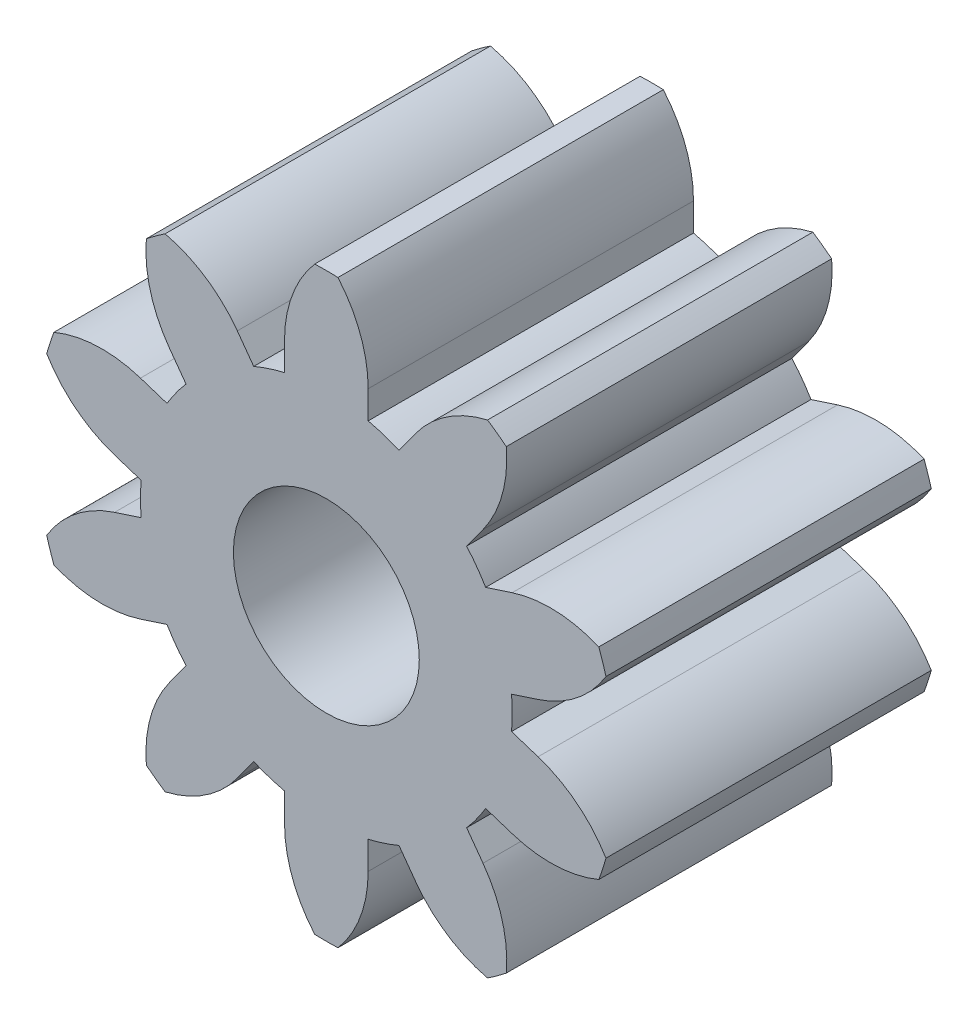
from build123d import *

# Parameters (mm, degrees)
ESBO_O1_R                = 2
RESSALTO_EXTRUS_O1_DEPTH = 3.5
CORTE_EXTRUS_O1_REACH    = 7.574
ESBO_O2_R                = 1


with BuildPart() as part:
    # Esboço1 → Ressalto-extrusão1 (new body)
    with BuildSketch(Plane.XY):
        Circle(ESBO_O1_R)
        with BuildLine():
            Line((-1.99959981, -1.122867364), (-1.714282855, -1.030162265))
            ThreePointArc((-1.714282855, -1.030162265), (-1.902113033, -0.618033989), (-1.99239815, -0.174211401))
            Line((-1.99239815, -0.174211401), (-2.277715105, -0.266916499))
            ThreePointArc((-2.277715105, -0.266916499), (-2.695113044, -0.490735084), (-3.008300145, -0.846023191))
            ThreePointArc((-3.008300145, -0.846023191), (-2.972051613, -0.965678107), (-2.931045896, -1.08378732))
            ThreePointArc((-2.931045896, -1.08378732), (-2.4688391, -1.187134677), (-1.99959981, -1.122867364))
        make_face()
        with BuildLine():
            Line((-2.277715105, 0.266916499), (-1.99239815, 0.174211401))
            ThreePointArc((-1.99239815, 0.174211401), (-1.902113033, 0.618033989), (-1.714282855, 1.030162265))
            Line((-1.714282855, 1.030162265), (-1.99959981, 1.122867364))
            ThreePointArc((-1.99959981, 1.122867364), (-2.4688391, 1.187134677), (-2.931045896, 1.08378732))
            ThreePointArc((-2.931045896, 1.08378732), (-2.972051613, 0.965678107), (-3.008300145, 0.846023191))
            ThreePointArc((-3.008300145, 0.846023191), (-2.695113044, 0.490735084), (-2.277715105, 0.266916499))
        make_face()
        with BuildLine():
            Line((-1.685820646, 1.554747331), (-1.509485071, 1.312042233))
            ThreePointArc((-1.509485071, 1.312042233), (-1.175570505, 1.618033989), (-0.781369776, 1.84104896))
            Line((-0.781369776, 1.84104896), (-0.957705351, 2.083754058))
            ThreePointArc((-0.957705351, 2.083754058), (-1.299552532, 2.411559342), (-1.734231738, 2.599627912))
            ThreePointArc((-1.734231738, 2.599627912), (-1.836828913, 2.528178107), (-1.936485986, 2.452681599))
            ThreePointArc((-1.936485986, 2.452681599), (-1.891945409, 1.981160724), (-1.685820646, 1.554747331))
        make_face()
        with BuildLine():
            Line((-0.45, 2.248717527), (-0.45, 1.948717527))
            ThreePointArc((-0.45, 1.948717527), (0, 2), (0.45, 1.948717527))
            Line((0.45, 1.948717527), (0.45, 2.248717527))
            ThreePointArc((0.45, 2.248717527), (0.366118933, 2.714850303), (0.125, 3.122498999))
            ThreePointArc((0.125, 3.122498999), (0, 3.125), (-0.125, 3.122498999))
            ThreePointArc((-0.125, 3.122498999), (-0.366118933, 2.714850303), (-0.45, 2.248717527))
        make_face()
        with BuildLine():
            ThreePointArc((0.781369776, 1.84104896), (1.175570505, 1.618033989), (1.509485071, 1.312042233))
            Line((1.509485071, 1.312042233), (1.685820646, 1.554747331))
            ThreePointArc((1.685820646, 1.554747331), (1.891945409, 1.981160724), (1.936485986, 2.452681599))
            ThreePointArc((1.936485986, 2.452681599), (1.836828913, 2.528178107), (1.734231738, 2.599627912))
            ThreePointArc((1.734231738, 2.599627912), (1.299552532, 2.411559342), (0.957705351, 2.083754058))
            Line((0.957705351, 2.083754058), (0.781369776, 1.84104896))
        make_face()
        with BuildLine():
            ThreePointArc((1.714282855, 1.030162265), (1.902113033, 0.618033989), (1.99239815, 0.174211401))
            Line((1.99239815, 0.174211401), (2.277715105, 0.266916499))
            ThreePointArc((2.277715105, 0.266916499), (2.695113044, 0.490735084), (3.008300145, 0.846023191))
            ThreePointArc((3.008300145, 0.846023191), (2.972051613, 0.965678107), (2.931045896, 1.08378732))
            ThreePointArc((2.931045896, 1.08378732), (2.4688391, 1.187134677), (1.99959981, 1.122867364))
            Line((1.99959981, 1.122867364), (1.714282855, 1.030162265))
        make_face()
        with BuildLine():
            ThreePointArc((1.99239815, -0.174211401), (1.902113033, -0.618033989), (1.714282855, -1.030162265))
            Line((1.714282855, -1.030162265), (1.99959981, -1.122867364))
            ThreePointArc((1.99959981, -1.122867364), (2.4688391, -1.187134677), (2.931045896, -1.08378732))
            ThreePointArc((2.931045896, -1.08378732), (2.972051613, -0.965678107), (3.008300145, -0.846023191))
            ThreePointArc((3.008300145, -0.846023191), (2.695113044, -0.490735084), (2.277715105, -0.266916499))
            Line((2.277715105, -0.266916499), (1.99239815, -0.174211401))
        make_face()
        with BuildLine():
            ThreePointArc((1.509485071, -1.312042233), (1.175570505, -1.618033989), (0.781369776, -1.84104896))
            Line((0.781369776, -1.84104896), (0.957705351, -2.083754058))
            ThreePointArc((0.957705351, -2.083754058), (1.299552532, -2.411559342), (1.734231738, -2.599627912))
            ThreePointArc((1.734231738, -2.599627912), (1.836828913, -2.528178107), (1.936485986, -2.452681599))
            ThreePointArc((1.936485986, -2.452681599), (1.891945409, -1.981160724), (1.685820646, -1.554747331))
            Line((1.685820646, -1.554747331), (1.509485071, -1.312042233))
        make_face()
        with BuildLine():
            Line((-0.45, -1.948717527), (-0.45, -2.248717527))
            ThreePointArc((-0.45, -2.248717527), (-0.366118933, -2.714850303), (-0.125, -3.122498999))
            ThreePointArc((-0.125, -3.122498999), (0, -3.125), (0.125, -3.122498999))
            ThreePointArc((0.125, -3.122498999), (0.366118933, -2.714850303), (0.45, -2.248717527))
            Line((0.45, -2.248717527), (0.45, -1.948717527))
            ThreePointArc((0.45, -1.948717527), (0, -2), (-0.45, -1.948717527))
        make_face()
        with BuildLine():
            Line((-0.957705351, -2.083754058), (-0.781369776, -1.84104896))
            ThreePointArc((-0.781369776, -1.84104896), (-1.175570505, -1.618033989), (-1.509485071, -1.312042233))
            Line((-1.509485071, -1.312042233), (-1.685820646, -1.554747331))
            ThreePointArc((-1.685820646, -1.554747331), (-1.891945409, -1.981160724), (-1.936485986, -2.452681599))
            ThreePointArc((-1.936485986, -2.452681599), (-1.836828913, -2.528178107), (-1.734231738, -2.599627912))
            ThreePointArc((-1.734231738, -2.599627912), (-1.299552532, -2.411559342), (-0.957705351, -2.083754058))
        make_face()
    extrude(amount=RESSALTO_EXTRUS_O1_DEPTH)

    # Esboço2 → Corte-extrusão1 (cut, up to next)
    with BuildSketch(Plane.XY.offset(3.5), mode=Mode.PRIVATE) as corte_extrus_o1_sk1:
        Circle(ESBO_O2_R)
    corte_extrus_o1_tool1 = extrude(corte_extrus_o1_sk1.sketch, amount=-CORTE_EXTRUS_O1_REACH, mode=Mode.PRIVATE) & part.part
    add(corte_extrus_o1_tool1.solids().sort_by_distance((0, 0, 3.5))[0], mode=Mode.SUBTRACT)


solid = part.part
